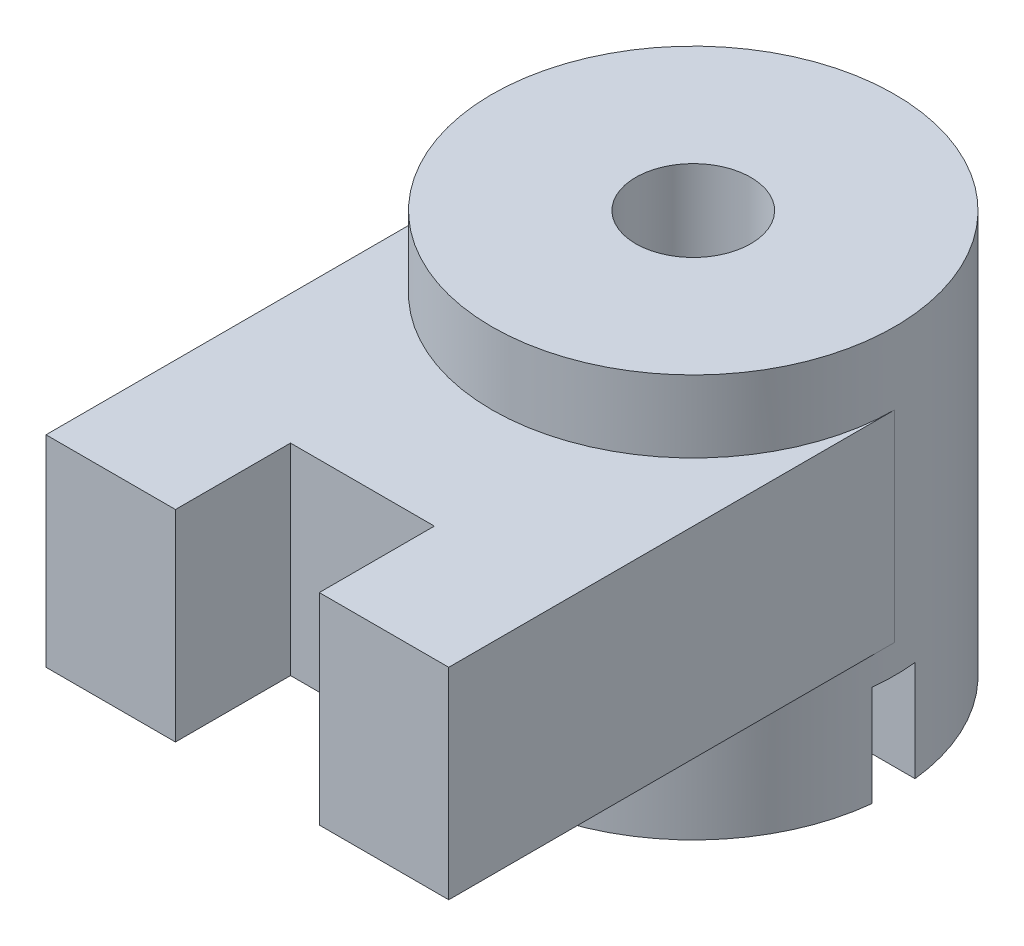
from build123d import *

# Parameters (mm, degrees)
ESQUISSE2_R                  = 70
ESQUISSE2_R_2                = 20
BOSS_EXTRU_1_DEPTH           = 140
ENL_V_MAT_EXTRU_1_DEPTH      = 172.464281995
ENL_V_MAT_EXTRU_1_DEPTH_BACK = 172.464281995
ESQUISSE3_W                  = 15
ESQUISSE3_H                  = 70
ESQUISSE7_W                  = 155
ESQUISSE7_H                  = 70
BOSS_EXTRU_3_DEPTH           = 70
ENL_V_MAT_EXTRU_5_DEPTH      = 206.304651676
ENL_V_MAT_EXTRU_5_DEPTH_BACK = 206.304651676
ESQUISSE11_W                 = 50
ESQUISSE11_H                 = 80
ESQUISSE10_R                 = 20
ENL_V_MAT_EXTRU_4_DEPTH      = 180


with BuildPart() as part:
    # Esquisse2 → Boss.-Extru.1 (new body)
    with BuildSketch(Plane(origin=(0, 0, 0), x_dir=(1, 0, 0), z_dir=(0, 1, 0))):
        with Locations(Location((0, 0, 0), (0, 0, 270))):
            Circle(ESQUISSE2_R)
        with Locations(Location((0, 0, 0), (0, 0, 270))):
            Circle(ESQUISSE2_R_2, mode=Mode.SUBTRACT)
    extrude(amount=BOSS_EXTRU_1_DEPTH)

    # Esquisse3 → Enlèv. mat.-Extru.1 (cut, two sides: drawn at the far end of the back side and taken through both)
    with BuildSketch(Plane(origin=(0, 0, 0), x_dir=(0, 0, -1), z_dir=(1, 0, 0)).offset(-ENL_V_MAT_EXTRU_1_DEPTH_BACK)):
        Rectangle(ESQUISSE3_W, ESQUISSE3_H)
    extrude(amount=ENL_V_MAT_EXTRU_1_DEPTH + ENL_V_MAT_EXTRU_1_DEPTH_BACK, mode=Mode.SUBTRACT)

    # Esquisse7 → Boss.-Extru.3 (add, symmetric)
    with BuildSketch(Plane(origin=(0, 0, 0), x_dir=(0, 0, -1), z_dir=(1, 0, 0))):
        with Locations((-77.5, 80)):
            Rectangle(ESQUISSE7_W, ESQUISSE7_H)
    extrude(amount=BOSS_EXTRU_3_DEPTH, both=True)

    # Esquisse11 → Enlèv. mat.-Extru.5 (cut, two sides: drawn at the far end of the back side and taken through both)
    with BuildSketch(Plane(origin=(0, 115, 0), x_dir=(1, 0, 0), z_dir=(0, 1, 0)).offset(-ENL_V_MAT_EXTRU_5_DEPTH_BACK)):
        with Locations((0, -155)):
            Rectangle(ESQUISSE11_W, ESQUISSE11_H)
    extrude(amount=ENL_V_MAT_EXTRU_5_DEPTH + ENL_V_MAT_EXTRU_5_DEPTH_BACK, mode=Mode.SUBTRACT)

    # Esquisse10 → Enlèv. mat.-Extru.4 (cut, symmetric)
    with BuildSketch(Plane(origin=(0, 140, 0), x_dir=(1, 0, 0), z_dir=(0, 1, 0))):
        with Locations(Location((0, 0, 0), (0, 0, 22.024312837))):
            Circle(ESQUISSE10_R)
    extrude(amount=ENL_V_MAT_EXTRU_4_DEPTH, both=True, mode=Mode.SUBTRACT)


solid = part.part
